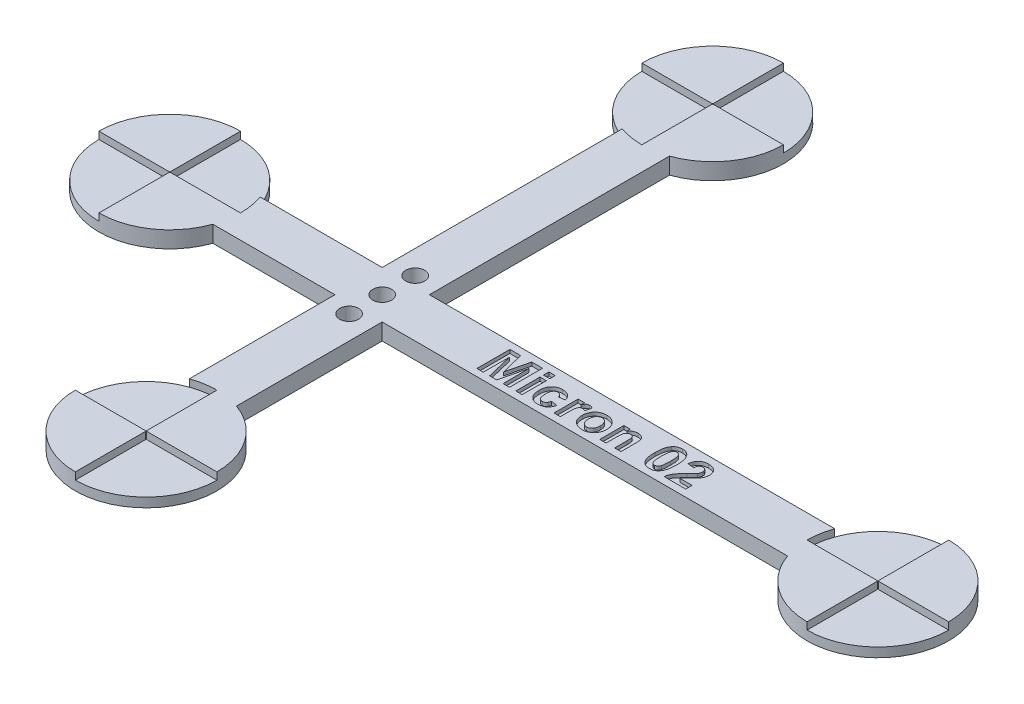
from build123d import *

# Parameters (mm, degrees)
BOSS_EXTRUDE1_DEPTH = 3.5
CUT_EXTRUDE1_START  = -1.52
CUT_EXTRUDE1_DEPTH  = 1.52
SKETCH3_R           = 2
CUT_EXTRUDE2_DEPTH  = 186.640108813
SKETCH5_W           = 1.346153846
SKETCH5_H           = 1.166666667
SKETCH5_H_2         = 5.115384615
CUT_EXTRUDE3_DEPTH  = 0.75


with BuildPart() as part:
    # Sketch1 → Boss-Extrude1 (new body)
    with BuildSketch(Plane(origin=(0, 0, 0), x_dir=(1, 0, 0), z_dir=(0, 1, 0))):
        with BuildLine():
            Line((40, 55.857864376), (40, 5))
            Line((40, 5), (14.142135624, 5))
            ThreePointArc((14.142135624, 5), (-15, 0), (14.142135624, -5))
            Line((14.142135624, -5), (40, -5))
            Line((40, -5), (40, -35.857864376))
            ThreePointArc((40, -35.857864376), (45, -65), (50, -35.857864376))
            Line((50, -35.857864376), (50, -5))
            Line((50, -5), (135.857864376, -5))
            ThreePointArc((135.857864376, -5), (165, 0), (135.857864376, 5))
            Line((135.857864376, 5), (50, 5))
            Line((50, 5), (50, 55.857864376))
            ThreePointArc((50, 55.857864376), (45, 85), (40, 55.857864376))
        make_face()
    extrude(amount=BOSS_EXTRUDE1_DEPTH)

    # Sketch2 → Cut-Extrude1 (cut)
    with BuildSketch(Plane(origin=(0, 3.5, 0), x_dir=(1, 0, 0), z_dir=(0, 1, 0)).offset(CUT_EXTRUDE1_START)):
        with BuildLine():
            Line((45, -65), (45, -50.1))
            ThreePointArc((45, -50.1), (44.929289322, -50.070710678), (44.9, -50))
            Line((44.9, -50), (30, -50))
            ThreePointArc((30, -50), (34.393398282, -39.393398282), (45, -35))
            Line((45, -35), (45, -49.9))
            ThreePointArc((45, -49.9), (45.070710678, -49.929289322), (45.1, -50))
            Line((45.1, -50), (60, -50))
            ThreePointArc((60, -50), (55.606601718, -60.606601718), (45, -65))
        make_face()
        with BuildLine():
            Line((-15, 0), (-0.1, 0))
            ThreePointArc((-0.1, 0), (-0.070710678, 0.070710678), (0, 0.1))
            Line((0, 0.1), (0, 15))
            ThreePointArc((0, 15), (10.606601718, 10.606601718), (15, 0))
            Line((15, 0), (0.1, 0))
            ThreePointArc((0.1, 0), (0.070710678, -0.070710678), (0, -0.1))
            Line((0, -0.1), (0, -15))
            ThreePointArc((0, -15), (-10.606601718, -10.606601718), (-15, 0))
        make_face()
        with BuildLine():
            Line((30, 70), (44.9, 70))
            ThreePointArc((44.9, 70), (44.929289322, 70.070710678), (45, 70.1))
            Line((45, 70.1), (45, 85))
            ThreePointArc((45, 85), (55.606601718, 80.606601718), (60, 70))
            Line((60, 70), (45.1, 70))
            ThreePointArc((45.1, 70), (45.070710678, 69.929289322), (45, 69.9))
            Line((45, 69.9), (45, 55))
            ThreePointArc((45, 55), (34.393398282, 59.393398282), (30, 70))
        make_face()
        with BuildLine():
            Line((150, 15), (150, 0.1))
            ThreePointArc((150, 0.1), (150.070710678, 0.070710678), (150.1, 0))
            Line((150.1, 0), (165, 0))
            ThreePointArc((165, 0), (160.606601718, -10.606601718), (150, -15))
            Line((150, -15), (150, -0.1))
            ThreePointArc((150, -0.1), (149.929289322, -0.070710678), (149.9, 0))
            Line((149.9, 0), (135, 0))
            ThreePointArc((135, 0), (139.393398282, 10.606601718), (150, 15))
        make_face()
    extrude(amount=CUT_EXTRUDE1_DEPTH, mode=Mode.SUBTRACT)

    # Sketch3 → Cut-Extrude2 (cut, through all)
    with BuildSketch(Plane(origin=(0, 3.5, 0), x_dir=(1, 0, 0), z_dir=(0, 1, 0))):
        with Locations(Location((45, 0, 0), (0, 0, 270))):
            Circle(SKETCH3_R)
        with Locations(Location((45, 7, 0), (0, 0, 270))):
            Circle(SKETCH3_R)
        with Locations(Location((45, -7, 0), (0, 0, 270))):
            Circle(SKETCH3_R)
    extrude(amount=-CUT_EXTRUDE2_DEPTH, mode=Mode.SUBTRACT)

    # Sketch5 → Cut-Extrude3 (cut)
    # profile 1 of 9: a face of its own
    with BuildSketch(Plane(origin=(0, 3.5, 0), x_dir=(1, 0, 0), z_dir=(0, 1, 0))):
        Polygon((68.557137316, -3.5), (68.557137316, 3.5), (70.834380906, 3.5), (72.012265521, -1.274639423), (73.190150137, 3.5), (75.467393727, 3.5), (75.467393727, -3.5), (74.12123988, -3.5), (74.076368086, 2.010817308), (72.762465842, -3.5), (71.262065201, -3.5), (69.948162957, 2.010817308), (69.903291162, -3.5), align=None)
    # profile 2 of 9: a face of its own
    with BuildSketch(Plane(origin=(0, 3.5, 0), x_dir=(1, 0, 0), z_dir=(0, 1, 0))):
        with Locations((77.486624496, 2.916666667)):
            Rectangle(SKETCH5_W, SKETCH5_H)
    # profile 3 of 9: a face of its own
    with BuildSketch(Plane(origin=(0, 3.5, 0), x_dir=(1, 0, 0), z_dir=(0, 1, 0))):
        with Locations((77.486624496, -0.942307692)):
            Rectangle(SKETCH5_W, SKETCH5_H_2)
    # profile 4 of 9: a face of its own
    with BuildSketch(Plane(origin=(0, 3.5, 0), x_dir=(1, 0, 0), z_dir=(0, 1, 0))):
        with BuildLine():
            Line((83.723803983, 0.08974359), (82.377650137, -0.08974359))
            add(Edge.make_bspline(
                [(82.377650137, -0.08974359), (82.365277654, -0.026702881), (82.341673882, 0.09356389), (82.281826173, 0.260113107), (82.199974577, 0.401670835), (82.097611893, 0.51732494), (81.97712351, 0.607450251), (81.840268759, 0.673171422), (81.685581657, 0.711401306), (81.577185865, 0.715710363), (81.520879304, 0.717948718)],
                knots=[0, 0, 0, 0, 1.183520367, 2.2578771, 3.246797608, 4.180863388, 5.085846032, 6.003342148, 6.962829327, 8, 8, 8, 8], degree=3))
            add(Edge.make_bspline(
                [(81.520879304, 0.717948718), (81.482498221, 0.716894897), (81.407684642, 0.714840756), (81.298251479, 0.698098117), (81.195737937, 0.667745464), (81.097523133, 0.629114343), (81.006836345, 0.576495155), (80.920991012, 0.514299213), (80.842675236, 0.439090326), (80.769257744, 0.353129964), (80.701753909, 0.253995306), (80.647051205, 0.137976859), (80.599085607, 0.00804074), (80.560102543, -0.137503523), (80.530047591, -0.298346655), (80.507427047, -0.474341951), (80.495339603, -0.665426066), (80.493822197, -0.797860734), (80.493034752, -0.866586538)],
                knots=[0, 0, 0, 0, 0.862078219, 1.680389174, 2.478024961, 3.259954283, 4.04533088, 4.826625376, 5.636266677, 6.477958853, 7.363321064, 8.321359119, 9.351280941, 10.472100686, 11.701575432, 13.024867311, 14.456081111, 16, 16, 16, 16], degree=3))
            add(Edge.make_bspline(
                [(80.493034752, -0.866586538), (80.493639899, -0.942801282), (80.494806774, -1.089762544), (80.509341595, -1.301712899), (80.531002417, -1.496036651), (80.561525189, -1.673267835), (80.601624875, -1.832782613), (80.650795425, -1.975411342), (80.707047794, -2.101633999), (80.776070584, -2.209065714), (80.850031931, -2.303056702), (80.933314865, -2.381466575), (81.019308158, -2.451942196), (81.114884123, -2.505825956), (81.214352737, -2.550853781), (81.321603773, -2.578852356), (81.433547011, -2.60039896), (81.510950539, -2.601834056), (81.550326419, -2.602564103)],
                knots=[0, 0, 0, 0, 1.594318435, 3.074248329, 4.44256617, 5.683784585, 6.834147545, 7.879495874, 8.83778105, 9.716843238, 10.544636748, 11.333080285, 12.105903466, 12.864046512, 13.621684801, 14.38335177, 15.177596319, 16, 16, 16, 16], degree=3))
            add(Edge.make_bspline(
                [(81.550326419, -2.602564103), (81.608100413, -2.600080116), (81.720157046, -2.595262252), (81.879276685, -2.552096012), (82.022202191, -2.482192159), (82.125844391, -2.400004579), (82.201111917, -2.320853296), (82.250138108, -2.247946339), (82.299458931, -2.168177702), (82.339930185, -2.075871785), (82.380235919, -1.975436952), (82.412480151, -1.86369039), (82.444507148, -1.743466381), (82.459601538, -1.65899259), (82.467393727, -1.615384615)],
                knots=[0, 0, 0, 0, 1.391704634, 2.699306801, 3.945045311, 5.206156062, 5.868460975, 6.572467336, 7.320954464, 8.128297893, 8.999513781, 9.930638866, 10.931732014, 12, 12, 12, 12], degree=3))
            Line((82.467393727, -1.615384615), (83.813547573, -1.794871795))
            add(Edge.make_bspline(
                [(83.813547573, -1.794871795), (83.795825896, -1.866656924), (83.76109447, -2.007343377), (83.693590707, -2.209373129), (83.61479608, -2.39820651), (83.525624874, -2.574376956), (83.422745577, -2.73598165), (83.309013151, -2.88413537), (83.183178776, -3.017960811), (83.046861568, -3.139555075), (82.897935718, -3.246410319), (82.736172899, -3.337665389), (82.563936639, -3.416820643), (82.378388792, -3.479144939), (82.181836268, -3.530502493), (81.972413371, -3.564327421), (81.751309208, -3.58604953), (81.599927011, -3.588491221), (81.522281547, -3.58974359)],
                knots=[0, 0, 0, 0, 1.110268429, 2.175934317, 3.195555169, 4.181481111, 5.137790904, 6.068820232, 6.982751273, 7.892872169, 8.808581235, 9.729898078, 10.678730826, 11.651191499, 12.666063818, 13.726769105, 14.834036833, 16, 16, 16, 16], degree=3))
            add(Edge.make_bspline(
                [(81.522281547, -3.58974359), (81.433837068, -3.587598112), (81.261478322, -3.583417051), (81.009756242, -3.550566524), (80.771780691, -3.496564037), (80.547501703, -3.418433664), (80.33596962, -3.32101378), (80.139359833, -3.198661043), (79.956602846, -3.055097693), (79.788125382, -2.890737636), (79.63650412, -2.707369312), (79.505615698, -2.505114604), (79.394554044, -2.286498364), (79.303031081, -2.051298732), (79.233226582, -1.7983952), (79.183681025, -1.529069784), (79.151714713, -1.243154327), (79.148519923, -1.047097203), (79.146880906, -0.946514423)],
                knots=[0, 0, 0, 0, 1.056003706, 2.057917874, 3.026125023, 3.965316587, 4.889355399, 5.801804771, 6.724223409, 7.659808022, 8.607570672, 9.559810849, 10.530974559, 11.531347954, 12.568834288, 13.659317828, 14.799164681, 16, 16, 16, 16], degree=3))
            add(Edge.make_bspline(
                [(79.146880906, -0.946514423), (79.148524185, -0.844997295), (79.151727972, -0.647076357), (79.18360297, -0.358828298), (79.233094763, -0.087580716), (79.30349607, 0.166297338), (79.392466257, 0.40326616), (79.504363423, 0.62183937), (79.635046938, 0.82419118), (79.786794153, 1.007446493), (79.954769379, 1.171954778), (80.138621428, 1.31436025), (80.335702579, 1.436043892), (80.547842096, 1.534147473), (80.773642785, 1.612120293), (81.013992037, 1.665925315), (81.268498667, 1.698802364), (81.442718724, 1.702983298), (81.532097252, 1.705128205)],
                knots=[0, 0, 0, 0, 1.206261992, 2.351765734, 3.442553085, 4.480484798, 5.479315179, 6.445885781, 7.393622348, 8.336902565, 9.26806234, 10.182699256, 11.09556262, 12.0152312, 12.955233282, 13.92969179, 14.937888647, 16, 16, 16, 16], degree=3))
            add(Edge.make_bspline(
                [(81.532097252, 1.705128205), (81.605070142, 1.704384231), (81.747559928, 1.702931518), (81.955377865, 1.681938632), (82.151931544, 1.652324627), (82.3370707, 1.608373074), (82.510877772, 1.55291005), (82.67305557, 1.48425635), (82.822943463, 1.401899226), (82.962440511, 1.308174096), (83.090726225, 1.200105), (83.210447231, 1.080931127), (83.320267383, 0.947732157), (83.421478043, 0.802315403), (83.510713897, 0.64234233), (83.592738582, 0.470830941), (83.663920966, 0.285320122), (83.703546565, 0.155903844), (83.723803983, 0.08974359)],
                knots=[0, 0, 0, 0, 1.178528697, 2.301242291, 3.371523624, 4.388184023, 5.372173667, 6.316227488, 7.228761945, 8.131556558, 9.02696084, 9.934795517, 10.857276148, 11.812560878, 12.793328268, 13.813516901, 14.882225015, 16, 16, 16, 16], degree=3))
        make_face()
    # profile 5 of 9: a face of its own
    with BuildSketch(Plane(origin=(0, 3.5, 0), x_dir=(1, 0, 0), z_dir=(0, 1, 0))):
        with BuildLine():
            Line((86.236624496, -3.5), (84.89047065, -3.5))
            Line((84.89047065, -3.5), (84.89047065, 1.615384615))
            Line((84.89047065, 1.615384615), (86.236624496, 1.615384615))
            Line((86.236624496, 1.615384615), (86.236624496, 0.901642628))
            add(Edge.make_bspline(
                [(86.236624496, 0.901642628), (86.259883743, 0.941904311), (86.304756328, 1.019578614), (86.371134323, 1.130348316), (86.437190473, 1.229067778), (86.502313101, 1.315738052), (86.562695006, 1.393610289), (86.624125097, 1.458290396), (86.681838486, 1.513862665), (86.759057766, 1.569417784), (86.85816177, 1.623638198), (86.982722375, 1.672376349), (87.116123027, 1.699014333), (87.206867798, 1.7030602), (87.253251098, 1.705128205)],
                knots=[0, 0, 0, 0, 1.218987753, 2.351715484, 3.384890168, 4.330893419, 5.1939795, 5.965577503, 6.66790098, 7.29043559, 8.453252551, 9.620708942, 10.783848683, 12, 12, 12, 12], degree=3))
            add(Edge.make_bspline(
                [(87.253251098, 1.705128205), (87.320405095, 1.701358096), (87.455282291, 1.693785921), (87.655090934, 1.639699112), (87.849368018, 1.548142305), (87.969512799, 1.464847397), (88.031496291, 1.421875)],
                knots=[0, 0, 0, 0, 0.956058025, 1.920219652, 2.927027487, 4, 4, 4, 4], degree=3))
            Line((88.031496291, 1.421875), (87.717393727, 0.141626603))
            add(Edge.make_bspline(
                [(87.717393727, 0.141626603), (87.664449803, 0.174925236), (87.563581431, 0.238365546), (87.406138295, 0.305762948), (87.25470486, 0.349888023), (87.154428404, 0.35601587), (87.106015521, 0.358974359)],
                knots=[0, 0, 0, 0, 1.139741959, 2.17142794, 3.117176162, 4, 4, 4, 4], degree=3))
            add(Edge.make_bspline(
                [(87.106015521, 0.358974359), (87.062383442, 0.357110478), (86.977443556, 0.353482004), (86.855168651, 0.324585509), (86.742438401, 0.278028965), (86.638804629, 0.211102954), (86.546124762, 0.117496866), (86.466335118, -0.005816935), (86.399557381, -0.159976511), (86.348517599, -0.309611834), (86.316692358, -0.455051639), (86.294248724, -0.593539742), (86.277196049, -0.759330249), (86.261585532, -0.951920701), (86.251121722, -1.171736755), (86.242884255, -1.418086441), (86.236934639, -1.691545137), (86.236731023, -1.882742337), (86.236624496, -1.982772436)],
                knots=[0, 0, 0, 0, 0.752818562, 1.4655346, 2.15662141, 2.850671748, 3.581264886, 4.414089304, 5.371394652, 6.476667933, 7.138571115, 7.940099809, 8.898357565, 10.015825393, 11.276710544, 12.698206094, 14.272575274, 16, 16, 16, 16], degree=3))
            Line((86.236624496, -1.982772436), (86.236624496, -3.5))
        make_face()
    # profile 6 of 9: a face of its own
    with BuildSketch(Plane(origin=(0, 3.5, 0), x_dir=(1, 0, 0), z_dir=(0, 1, 0))):
        with BuildLine():
            add(Edge.make_bspline(
                [(88.30072706, -0.870793269), (88.305045962, -0.760235903), (88.313692137, -0.538906871), (88.37545065, -0.210134176), (88.479986613, 0.112038713), (88.596998472, 0.373436964), (88.712536167, 0.573274145), (88.805840225, 0.717377785), (88.910004027, 0.850655554), (89.022895624, 0.973952054), (89.141975554, 1.090223099), (89.271436787, 1.195191373), (89.409604934, 1.290665645), (89.555130892, 1.377699163), (89.70780662, 1.45411696), (89.864797668, 1.522044624), (90.026738449, 1.577858255), (90.192500665, 1.624143401), (90.362803099, 1.66126573), (90.537692719, 1.68557028), (90.716957733, 1.701776453), (90.837816813, 1.704000672), (90.899084432, 1.705128205)],
                knots=[0, 0, 0, 0, 1.619840069, 3.242819969, 4.882696853, 6.574901176, 7.427927767, 8.263869039, 9.088735507, 9.903385011, 10.712399333, 11.525463381, 12.34252837, 13.171904741, 14.008210778, 14.842888174, 15.67691885, 16.516221154, 17.363978437, 18.229048737, 19.10224397, 20, 20, 20, 20], degree=3))
            add(Edge.make_bspline(
                [(90.899084432, 1.705128205), (90.992210311, 1.703136544), (91.175407967, 1.69921854), (91.443599, 1.663530133), (91.69856042, 1.604734262), (91.940636298, 1.522866388), (92.170009096, 1.417918164), (92.385525042, 1.287469155), (92.588964705, 1.13534666), (92.776477597, 0.960622814), (92.947873031, 0.769310702), (93.096522834, 0.562484273), (93.223397384, 0.344144411), (93.328477544, 0.113944009), (93.408239879, -0.129331778), (93.463344151, -0.385087436), (93.500243667, -0.652374343), (93.50396088, -0.835142162), (93.505855265, -0.928285256)],
                knots=[0, 0, 0, 0, 1.076054793, 2.116819909, 3.120736197, 4.09633837, 5.065772102, 6.030360709, 7.002891056, 7.996945094, 8.988102315, 9.967288529, 10.93568283, 11.902870597, 12.887008047, 13.888537105, 14.923945207, 16, 16, 16, 16], degree=3))
            add(Edge.make_bspline(
                [(93.505855265, -0.928285256), (93.503953336, -1.022358858), (93.500230128, -1.20651696), (93.463550334, -1.47628572), (93.406832368, -1.734301905), (93.325441844, -1.980042151), (93.220586913, -2.213224526), (93.094263796, -2.434645511), (92.943126034, -2.643140663), (92.770071096, -2.836536926), (92.580135887, -3.012216977), (92.378157233, -3.168393642), (92.161698021, -3.297146595), (91.934555313, -3.405413896), (91.694392155, -3.48757604), (91.442576838, -3.546181121), (91.179301383, -3.58440277), (90.999247208, -3.587940756), (90.907497893, -3.58974359)],
                knots=[0, 0, 0, 0, 1.084306555, 2.122634113, 3.133511532, 4.127271514, 5.10202058, 6.077484774, 7.061903265, 8.065960046, 9.065303363, 10.042062392, 11.004391854, 11.964060687, 12.939122686, 13.924942149, 14.942623041, 16, 16, 16, 16], degree=3))
            add(Edge.make_bspline(
                [(90.907497893, -3.58974359), (90.793197459, -3.585999314), (90.565409876, -3.578537406), (90.228332141, -3.517331391), (89.899580393, -3.418578363), (89.634721788, -3.30491006), (89.432398884, -3.194068459), (89.2889167, -3.100765628), (89.153600151, -3.000634417), (89.029615405, -2.888525117), (88.914822638, -2.767656905), (88.80770116, -2.639200059), (88.712065202, -2.500189519), (88.625243515, -2.353150853), (88.547337372, -2.197033104), (88.482391397, -2.031407384), (88.425965203, -1.858219085), (88.379426741, -1.677074935), (88.344918868, -1.487198195), (88.319828269, -1.289197267), (88.304105213, -1.082783839), (88.301867118, -0.942335777), (88.30072706, -0.870793269)],
                knots=[0, 0, 0, 0, 1.610846835, 3.210231987, 4.81374032, 6.443368681, 7.263437361, 8.06418174, 8.855100662, 9.634539345, 10.417731031, 11.204243685, 11.990424874, 12.794120493, 13.610605693, 14.447765341, 15.300248309, 16.177865431, 17.082777535, 18.019649293, 18.991233806, 20, 20, 20, 20], degree=3))
        make_face()
        with BuildLine():
            add(Edge.make_bspline(
                [(89.646880906, -0.942307692), (89.647878584, -1.007320767), (89.649820064, -1.133836228), (89.667123886, -1.317908247), (89.693943922, -1.490762442), (89.735361519, -1.650791958), (89.785307076, -1.800159307), (89.848707519, -1.936877885), (89.921153825, -2.063536994), (90.007373027, -2.1753987), (90.101343593, -2.274418694), (90.199833871, -2.36240354), (90.303809872, -2.437322036), (90.41391022, -2.49823268), (90.529998823, -2.544473448), (90.650705668, -2.578404662), (90.776898878, -2.59833825), (90.862556349, -2.601139991), (90.90609565, -2.602564103)],
                knots=[0, 0, 0, 0, 1.334287467, 2.596523749, 3.792235791, 4.920928783, 5.98599801, 7.020725633, 8.009778093, 8.975087571, 9.91178927, 10.809031968, 11.682407688, 12.537028737, 13.385161363, 14.241880569, 15.106355953, 16, 16, 16, 16], degree=3))
            add(Edge.make_bspline(
                [(90.90609565, -2.602564103), (90.949636837, -2.601144665), (91.035298021, -2.598352119), (91.161464162, -2.578351489), (91.281853749, -2.544786823), (91.397190506, -2.497854846), (91.507005984, -2.437377328), (91.61091724, -2.362353397), (91.709336483, -2.274781598), (91.802542893, -2.175227372), (91.886267606, -2.061842509), (91.959423839, -1.935578805), (92.022822325, -1.79833688), (92.072998654, -1.64817726), (92.112146338, -1.486306038), (92.139600285, -1.312329148), (92.15676443, -1.126346658), (92.158702325, -0.99843674), (92.159701419, -0.932491987)],
                knots=[0, 0, 0, 0, 0.891374549, 1.753654511, 2.608197993, 3.445305504, 4.297756158, 5.168913853, 6.063877914, 6.991658187, 7.956416983, 8.942957645, 9.975057474, 11.046479855, 12.179282068, 13.381405243, 14.649967197, 16, 16, 16, 16], degree=3))
            add(Edge.make_bspline(
                [(92.159701419, -0.932491987), (92.158697367, -0.867950124), (92.156751088, -0.742840612), (92.139683714, -0.561031756), (92.111771172, -0.390422553), (92.073298945, -0.231185172), (92.022561895, -0.083047614), (91.959026888, 0.052619974), (91.886748624, 0.178516236), (91.80205349, 0.290714614), (91.709395678, 0.390209804), (91.610902071, 0.477726842), (91.507009908, 0.552764833), (91.397189486, 0.61323871), (91.281854027, 0.660171642), (91.161464087, 0.693736048), (91.035298041, 0.713736749), (90.949636844, 0.716529285), (90.90609565, 0.717948718)],
                knots=[0, 0, 0, 0, 1.332105243, 2.582185114, 3.76554119, 4.898206757, 5.96011018, 6.991864232, 7.986448439, 8.951336849, 9.886681577, 10.788942532, 11.667203022, 12.526603947, 13.370536632, 14.232047448, 15.101357822, 16, 16, 16, 16], degree=3))
            add(Edge.make_bspline(
                [(90.90609565, 0.717948718), (90.862556349, 0.716524606), (90.776898878, 0.713722865), (90.650705668, 0.693789278), (90.529998823, 0.659858063), (90.41391022, 0.613617296), (90.303809872, 0.552706651), (90.199833871, 0.477788156), (90.101343593, 0.38980331), (90.007373027, 0.290783316), (89.921153825, 0.17892161), (89.848707519, 0.052262501), (89.785307076, -0.084456078), (89.735361519, -0.233823426), (89.693943922, -0.393852943), (89.667123886, -0.566707137), (89.649820064, -0.750779157), (89.647878584, -0.877294617), (89.646880906, -0.942307692)],
                knots=[0, 0, 0, 0, 0.893644047, 1.758119431, 2.614838637, 3.462971263, 4.317592312, 5.190968032, 6.08821073, 7.024912429, 7.990221907, 8.979274367, 10.01400199, 11.079071217, 12.207764209, 13.403476251, 14.665712533, 16, 16, 16, 16], degree=3))
        make_face(mode=Mode.SUBTRACT)
    # profile 7 of 9: a face of its own
    with BuildSketch(Plane(origin=(0, 3.5, 0), x_dir=(1, 0, 0), z_dir=(0, 1, 0))):
        with BuildLine():
            Line((99.069957829, -3.5), (97.723803983, -3.5))
            Line((97.723803983, -3.5), (97.723803983, -0.875))
            add(Edge.make_bspline(
                [(97.723803983, -0.875), (97.723602692, -0.80862339), (97.723218494, -0.681932094), (97.718527885, -0.50151225), (97.713477967, -0.33926398), (97.705359809, -0.195690673), (97.69420945, -0.069881136), (97.680940928, 0.037381776), (97.664227581, 0.126316058), (97.640514055, 0.219075396), (97.603280694, 0.31750614), (97.542853534, 0.419454306), (97.472803641, 0.509977418), (97.387946168, 0.584030176), (97.292843867, 0.643744945), (97.188425092, 0.687766967), (97.073926815, 0.713473714), (96.994769027, 0.71642676), (96.953972252, 0.717948718)],
                knots=[0, 0, 0, 0, 1.585090075, 3.025419896, 4.30986405, 5.461533023, 6.458985685, 7.325703005, 8.041573048, 8.618245387, 9.611190897, 10.541623111, 11.439410311, 12.333024322, 13.215695708, 14.111259627, 15.026570636, 16, 16, 16, 16], degree=3))
            add(Edge.make_bspline(
                [(96.953972252, 0.717948718), (96.901446439, 0.715341443), (96.798008909, 0.710207014), (96.646127096, 0.674643139), (96.504272122, 0.611656212), (96.371854194, 0.527573319), (96.255091054, 0.423166044), (96.155813236, 0.301229295), (96.077510643, 0.163292863), (96.028725935, 0.034500293), (95.9997776, -0.082074788), (95.980077313, -0.18736516), (95.965963353, -0.310222482), (95.951055688, -0.449397921), (95.942646526, -0.606201002), (95.933263474, -0.779079665), (95.929808832, -0.969405207), (95.929233196, -1.1016966), (95.928932188, -1.170873397)],
                knots=[0, 0, 0, 0, 1.032418065, 2.033110358, 3.045378521, 4.070039643, 5.104744895, 6.110696385, 7.147805894, 8.209255037, 8.806501049, 9.507534436, 10.313289552, 11.236712342, 12.258650821, 13.399345464, 14.640085731, 16, 16, 16, 16], degree=3))
            Line((95.928932188, -1.170873397), (95.928932188, -3.5))
            Line((95.928932188, -3.5), (94.582778342, -3.5))
            Line((94.582778342, -3.5), (94.582778342, 1.615384615))
            Line((94.582778342, 1.615384615), (95.928932188, 1.615384615))
            Line((95.928932188, 1.615384615), (95.928932188, 0.877804487))
            add(Edge.make_bspline(
                [(95.928932188, 0.877804487), (95.980976174, 0.94337945), (96.08236259, 1.07112544), (96.252101926, 1.240902011), (96.431871591, 1.384984638), (96.622482327, 1.502597736), (96.823836354, 1.593383288), (97.035011442, 1.657323362), (97.256181645, 1.698687167), (97.407176778, 1.702955825), (97.484020329, 1.705128205)],
                knots=[0, 0, 0, 0, 1.096260936, 2.135615983, 3.138008533, 4.108575778, 5.062498258, 6.023394349, 6.994077526, 8, 8, 8, 8], degree=3))
            add(Edge.make_bspline(
                [(97.484020329, 1.705128205), (97.551455459, 1.703432581), (97.684254807, 1.700093404), (97.87840855, 1.668042033), (98.063790206, 1.617716821), (98.237815142, 1.547521772), (98.39780225, 1.463814733), (98.538360931, 1.365944084), (98.659178646, 1.258012012), (98.758264399, 1.136836476), (98.838935335, 1.006444736), (98.909151731, 0.869613801), (98.963410859, 0.7231182), (99.005291646, 0.56393665), (99.033684021, 0.383505727), (99.056317805, 0.173923523), (99.067737625, -0.069988674), (99.069186888, -0.243982006), (99.069957829, -0.336538462)],
                knots=[0, 0, 0, 0, 1.087471829, 2.141547729, 3.166311014, 4.181815879, 5.163737, 6.073971965, 6.939083136, 7.769667735, 8.590016746, 9.409741311, 10.247555639, 11.105633939, 12.06171977, 13.192085209, 14.506318385, 16, 16, 16, 16], degree=3))
            Line((99.069957829, -0.336538462), (99.069957829, -3.5))
        make_face()
    # profile 8 of 9: a face of its own
    with BuildSketch(Plane(origin=(0, 3.5, 0), x_dir=(1, 0, 0), z_dir=(0, 1, 0))):
        with BuildLine():
            add(Edge.make_bspline(
                [(105.127650137, 3.5), (105.210973459, 3.497990296), (105.373194416, 3.494077632), (105.609568213, 3.459418509), (105.832125907, 3.403844539), (106.040851165, 3.325286793), (106.235548447, 3.223275021), (106.414920872, 3.097373283), (106.582887972, 2.951355615), (106.679882834, 2.838043484), (106.729012316, 2.780649038)],
                knots=[0, 0, 0, 0, 1.098584764, 2.138818609, 3.143716932, 4.11936356, 5.073598562, 6.034819447, 7.004603936, 8, 8, 8, 8], degree=3))
            add(Edge.make_bspline(
                [(106.729012316, 2.780649038), (106.757115165, 2.744096358), (106.814468155, 2.669498744), (106.89170974, 2.548957239), (106.965967015, 2.421089291), (107.030786368, 2.282817073), (107.092853708, 2.136540065), (107.150372484, 1.981924967), (107.200314244, 1.817694297), (107.24730652, 1.645948025), (107.285600914, 1.464003892), (107.320988477, 1.273826094), (107.350326359, 1.07455247), (107.373461009, 0.866820582), (107.394122544, 0.650946485), (107.405444064, 0.425900053), (107.414713976, 0.192183791), (107.415640415, 0.033196977), (107.416111675, -0.047676282)],
                knots=[0, 0, 0, 0, 0.746761706, 1.524009783, 2.317797294, 3.140957436, 3.996208027, 4.892396322, 5.812273159, 6.776774596, 7.776522781, 8.823794876, 9.910947555, 11.039215469, 12.21036455, 13.424061321, 14.689674014, 16, 16, 16, 16], degree=3))
            add(Edge.make_bspline(
                [(107.416111675, -0.047676282), (107.415647514, -0.128549727), (107.414737711, -0.287069766), (107.405409505, -0.520317147), (107.394112451, -0.744894367), (107.37350921, -0.960779993), (107.350153056, -1.168470585), (107.32165396, -1.36752083), (107.283603433, -1.556824756), (107.245911455, -1.7384787), (107.199194678, -1.910956219), (107.147008626, -2.074892373), (107.09180168, -2.231434895), (107.028291268, -2.377900211), (106.961146178, -2.516343538), (106.887993989, -2.64551665), (106.809889936, -2.766805201), (106.751982092, -2.841796361), (106.723403342, -2.87880609)],
                knots=[0, 0, 0, 0, 1.308387162, 2.564569672, 3.776470597, 4.945886788, 6.07248526, 7.158029334, 8.197718558, 9.195987466, 10.159061779, 11.087054987, 11.979325145, 12.84323098, 13.668471539, 14.467659354, 15.243757377, 16, 16, 16, 16], degree=3))
            add(Edge.make_bspline(
                [(106.723403342, -2.87880609), (106.674723363, -2.935708583), (106.578626735, -3.048036851), (106.412518637, -3.192843578), (106.233443571, -3.316141502), (106.039089218, -3.416126038), (105.831383863, -3.495225841), (105.60846196, -3.549026443), (105.372733911, -3.583756125), (105.210509985, -3.587719301), (105.127650137, -3.58974359)],
                knots=[0, 0, 0, 0, 0.991631672, 1.957528776, 2.911425699, 3.867574088, 4.848108326, 5.850523106, 6.902101959, 8, 8, 8, 8], degree=3))
            add(Edge.make_bspline(
                [(105.127650137, -3.58974359), (105.043843229, -3.587332075), (104.87961925, -3.582606588), (104.639845122, -3.545146301), (104.411928808, -3.485135154), (104.196688524, -3.399455235), (103.99443224, -3.288420347), (103.80357985, -3.155320137), (103.628283527, -2.994127791), (103.491045634, -2.844066609), (103.390641979, -2.708475295), (103.319827907, -2.596038127), (103.251393654, -2.475725869), (103.192326668, -2.343776957), (103.134051837, -2.204094043), (103.08243865, -2.05366677), (103.036902449, -1.893788664), (102.994146853, -1.725189777), (102.958494985, -1.546708789), (102.925700499, -1.358872406), (102.899856676, -1.160881808), (102.876943465, -0.953839776), (102.860811252, -0.737257565), (102.847709837, -0.5114896), (102.841140381, -0.275813207), (102.839847904, -0.115454427), (102.839188598, -0.033653846)],
                knots=[0, 0, 0, 0, 1.257818097, 2.464759732, 3.634271214, 4.790227596, 5.933394726, 7.09190477, 8.274482889, 9.50191983, 10.139172818, 10.805000628, 11.49619854, 12.215266328, 12.973768034, 13.768328009, 14.601232062, 15.469317089, 16.379095881, 17.333267023, 18.331755967, 19.376479622, 20.460535752, 21.592206075, 22.771760786, 24, 24, 24, 24], degree=3))
            add(Edge.make_bspline(
                [(102.839188598, -0.033653846), (102.839649053, 0.046752502), (102.840551486, 0.204338611), (102.849947717, 0.43664665), (102.861095479, 0.6603017), (102.881922973, 0.875695222), (102.904951542, 1.082498955), (102.93397868, 1.280985552), (102.971083155, 1.47012808), (103.011481896, 1.65068144), (103.055796554, 1.823285057), (103.10846774, 1.986496157), (103.163122902, 2.142783223), (103.227375619, 2.288467292), (103.294108477, 2.426619238), (103.367317908, 2.555768146), (103.445407553, 2.677062789), (103.503317262, 2.75205316), (103.531896932, 2.7890625)],
                knots=[0, 0, 0, 0, 1.304469132, 2.556591843, 3.77188756, 4.93702727, 6.066781583, 7.147865049, 8.190466662, 9.19316792, 10.149665317, 11.080258032, 11.975027628, 12.834388201, 13.661940433, 14.463366943, 15.241638981, 16, 16, 16, 16], degree=3))
            add(Edge.make_bspline(
                [(103.531896932, 2.7890625), (103.580574234, 2.845970467), (103.676665577, 2.958309541), (103.842812364, 3.103037161), (104.022085413, 3.226867293), (104.217008558, 3.32565506), (104.424237765, 3.405839286), (104.646867933, 3.45921057), (104.882558423, 3.494031913), (105.044787604, 3.497982262), (105.127650137, 3.5)],
                knots=[0, 0, 0, 0, 0.991667276, 1.957599061, 2.911530233, 3.873218945, 4.847995157, 5.850445929, 6.902062539, 8, 8, 8, 8], degree=3))
        make_face()
        with BuildLine():
            add(Edge.make_bspline(
                [(105.127650137, 2.333333333), (105.08496527, 2.331377346), (105.000530703, 2.327508224), (104.877806939, 2.298834269), (104.761904466, 2.251515994), (104.65226456, 2.185460295), (104.551309982, 2.09356773), (104.46579241, 1.970359526), (104.391937624, 1.819162626), (104.35497736, 1.706149177), (104.335382509, 1.646233974)],
                knots=[0, 0, 0, 0, 0.899391665, 1.779078861, 2.640979247, 3.529945348, 4.464599804, 5.495588918, 6.672261578, 8, 8, 8, 8], degree=3))
            add(Edge.make_bspline(
                [(104.335382509, 1.646233974), (104.323145186, 1.601026296), (104.296843942, 1.503863032), (104.266993122, 1.34544653), (104.242375766, 1.165660571), (104.221588896, 0.964546936), (104.204672766, 0.741999201), (104.19425523, 0.497875761), (104.187054818, 0.232347672), (104.185928426, 0.048149154), (104.185342445, -0.047676282)],
                knots=[0, 0, 0, 0, 0.658986521, 1.416336438, 2.266694271, 3.212608458, 4.261595115, 5.407496572, 6.651304179, 8, 8, 8, 8], degree=3))
            add(Edge.make_bspline(
                [(104.185342445, -0.047676282), (104.186141326, -0.14302767), (104.187672646, -0.32580029), (104.19202109, -0.588135115), (104.204364221, -0.826933735), (104.216718503, -1.043147789), (104.237295105, -1.23609601), (104.257990887, -1.406299418), (104.286516619, -1.552595599), (104.325438332, -1.711718991), (104.384302432, -1.878266865), (104.465062219, -2.04628923), (104.551664335, -2.181203321), (104.6536661, -2.277800907), (104.764061896, -2.342600939), (104.878564469, -2.390212927), (105.001176477, -2.416929723), (105.084994509, -2.421003664), (105.127650137, -2.423076923)],
                knots=[0, 0, 0, 0, 1.613353868, 3.092528792, 4.438413522, 5.658843895, 6.755779493, 7.721003256, 8.558527904, 9.275869043, 10.491421475, 11.538327284, 12.426656321, 13.187490948, 13.890032692, 14.581719216, 15.278226227, 16, 16, 16, 16], degree=3))
            add(Edge.make_bspline(
                [(105.127650137, -2.423076923), (105.1708259, -2.421220141), (105.255319219, -2.417586488), (105.378203772, -2.38795648), (105.494271269, -2.342061023), (105.60317755, -2.274658528), (105.704037572, -2.183395172), (105.789492715, -2.06007625), (105.863367243, -1.908914362), (105.900324505, -1.795895589), (105.919917765, -1.735977564)],
                knots=[0, 0, 0, 0, 0.909107913, 1.77908945, 2.650019014, 3.530482969, 4.465025013, 5.495890128, 6.672421267, 8, 8, 8, 8], degree=3))
            add(Edge.make_bspline(
                [(105.919917765, -1.735977564), (105.932137385, -1.690766299), (105.958280861, -1.594038281), (105.988344392, -1.436607964), (106.013028395, -1.257753647), (106.033617624, -1.05755488), (106.050700146, -0.835487867), (106.061029249, -0.591824852), (106.068236435, -0.326765589), (106.06936967, -0.143034371), (106.069957829, -0.047676282)],
                knots=[0, 0, 0, 0, 0.66114423, 1.414496391, 2.261103113, 3.210114492, 4.255954433, 5.405607896, 6.653488082, 8, 8, 8, 8], degree=3))
            add(Edge.make_bspline(
                [(106.069957829, -0.047676282), (106.070022861, 0.04768509), (106.070147527, 0.230491244), (106.061887947, 0.493159052), (106.05378189, 0.732661087), (106.037252258, 0.948528178), (106.020696375, 1.141489365), (105.996032219, 1.310578558), (105.971185025, 1.457659427), (105.92872111, 1.616451226), (105.871012304, 1.783477729), (105.79217116, 1.953246036), (105.703049418, 2.086895444), (105.601786966, 2.185134457), (105.491934543, 2.251358804), (105.377150964, 2.29911527), (105.254748437, 2.32746093), (105.170327908, 2.331361465), (105.127650137, 2.333333333)],
                knots=[0, 0, 0, 0, 1.611146624, 3.088541111, 4.440175916, 5.659517762, 6.746360572, 7.711365618, 8.546319149, 9.264661039, 10.486047304, 11.528122518, 12.419721574, 13.184982167, 13.89070983, 14.574167459, 15.279187713, 16, 16, 16, 16], degree=3))
        make_face(mode=Mode.SUBTRACT)
    # profile 9 of 9: a face of its own
    with BuildSketch(Plane(origin=(0, 3.5, 0), x_dir=(1, 0, 0), z_dir=(0, 1, 0))):
        with BuildLine():
            Line((112.80072706, -2.153846154), (112.80072706, -3.5))
            Line((112.80072706, -3.5), (108.223803983, -3.5))
            add(Edge.make_bspline(
                [(108.223803983, -3.5), (108.239300384, -3.384951622), (108.270284497, -3.154919376), (108.366076298, -2.818900164), (108.493925539, -2.491002823), (108.632681607, -2.224173978), (108.770689886, -2.00938594), (108.895904805, -1.833386961), (109.045281606, -1.646131603), (109.216652669, -1.446108194), (109.409070929, -1.232691466), (109.623971949, -1.006674857), (109.86238084, -0.76914037), (110.030105742, -0.607842767), (110.116832829, -0.524439103)],
                knots=[0, 0, 0, 0, 1.156289446, 2.311930546, 3.473459201, 4.661751613, 5.303057008, 6.018253237, 6.81459331, 7.690699809, 8.644447906, 9.679642995, 10.800191253, 12, 12, 12, 12], degree=3))
            add(Edge.make_bspline(
                [(110.116832829, -0.524439103), (110.186042037, -0.45763327), (110.317795984, -0.330454639), (110.50541386, -0.148339996), (110.670349307, 0.019075127), (110.816050895, 0.167452284), (110.939152712, 0.300569533), (111.041274049, 0.41633629), (111.123708261, 0.515223992), (111.168354702, 0.577958412), (111.188146932, 0.605769231)],
                knots=[0, 0, 0, 0, 1.480720495, 2.818855715, 4.024636094, 5.098235712, 6.019786162, 6.815086302, 7.474715479, 8, 8, 8, 8], degree=3))
            add(Edge.make_bspline(
                [(111.188146932, 0.605769231), (111.228676588, 0.673093319), (111.306853598, 0.802953685), (111.392581176, 1.007161459), (111.444038063, 1.21132705), (111.45109934, 1.34774933), (111.454573214, 1.414863782)],
                knots=[0, 0, 0, 0, 1.0911822, 2.104764037, 3.067617678, 4, 4, 4, 4], degree=3))
            add(Edge.make_bspline(
                [(111.454573214, 1.414863782), (111.452052047, 1.484705392), (111.447282197, 1.616840272), (111.407286178, 1.80330702), (111.336359729, 1.963601606), (111.238707062, 2.098216057), (111.115225067, 2.203685963), (110.970871025, 2.281617987), (110.803531824, 2.324704239), (110.685915961, 2.330371425), (110.624445009, 2.333333333)],
                knots=[0, 0, 0, 0, 1.193122327, 2.257294386, 3.237245624, 4.168877528, 5.075331632, 5.990371598, 6.949684428, 8, 8, 8, 8], degree=3))
            add(Edge.make_bspline(
                [(110.624445009, 2.333333333), (110.563389349, 2.330567133), (110.445442995, 2.32522343), (110.277815636, 2.278541576), (110.131172635, 2.197730376), (110.026667033, 2.105638219), (109.956068542, 2.016085284), (109.907965193, 1.938045801), (109.866503861, 1.849369016), (109.829765662, 1.751053282), (109.800746639, 1.641972289), (109.777376519, 1.522956797), (109.758543584, 1.393366336), (109.752554378, 1.303213961), (109.749445009, 1.256410256)],
                knots=[0, 0, 0, 0, 1.402788338, 2.709884207, 3.961032948, 5.225417836, 5.883680772, 6.578928686, 7.329201998, 8.132101139, 8.990263233, 9.922304639, 10.921339128, 12, 12, 12, 12], degree=3))
            Line((109.749445009, 1.256410256), (108.403291162, 1.388221154))
            add(Edge.make_bspline(
                [(108.403291162, 1.388221154), (108.414114031, 1.479103506), (108.435097844, 1.655309865), (108.4874633, 1.908402953), (108.55378221, 2.14189275), (108.637216219, 2.355345943), (108.734316899, 2.550119887), (108.850037193, 2.723291877), (108.980333711, 2.876780169), (109.125319057, 3.010503073), (109.284071514, 3.124885996), (109.450653733, 3.226990308), (109.628321194, 3.310748301), (109.815117775, 3.379777472), (110.010959057, 3.434945033), (110.216750834, 3.471421076), (110.431223035, 3.497078465), (110.577622655, 3.499011478), (110.65248988, 3.5)],
                knots=[0, 0, 0, 0, 1.270971563, 2.464210789, 3.586263665, 4.638946707, 5.643716971, 6.603612468, 7.52484387, 8.434700188, 9.336036235, 10.239171475, 11.145359471, 12.059630629, 13.003312604, 13.96741569, 14.960557767, 16, 16, 16, 16], degree=3))
            add(Edge.make_bspline(
                [(110.65248988, 3.5), (110.733880227, 3.49843572), (110.892398146, 3.495389088), (111.123806166, 3.470229976), (111.341197375, 3.426361419), (111.546472358, 3.368251307), (111.737523052, 3.290670059), (111.915941474, 3.196877555), (112.078919632, 3.083314181), (112.228886936, 2.956173031), (112.362945707, 2.81635899), (112.480369059, 2.667223677), (112.578745958, 2.508870995), (112.661299282, 2.343231088), (112.722594569, 2.167638569), (112.76725698, 1.984521403), (112.796869958, 1.793025307), (112.79942714, 1.662237818), (112.80072706, 1.595753205)],
                knots=[0, 0, 0, 0, 1.210756838, 2.35810096, 3.457354827, 4.507168606, 5.527358126, 6.519769748, 7.499700793, 8.476517721, 9.440526811, 10.376769937, 11.295256217, 12.209626307, 13.124630862, 14.055668209, 15.011616881, 16, 16, 16, 16], degree=3))
            add(Edge.make_bspline(
                [(112.80072706, 1.595753205), (112.799014433, 1.519449993), (112.795616843, 1.368076128), (112.763087443, 1.144300333), (112.713388852, 0.92568478), (112.639938248, 0.711695192), (112.546833906, 0.497198456), (112.426820177, 0.281713114), (112.28747516, 0.058740511), (112.178373504, -0.085421006), (112.122041162, -0.159855769)],
                knots=[0, 0, 0, 0, 0.953409949, 1.89141903, 2.821310783, 3.752688675, 4.715703262, 5.740811754, 6.833515735, 8, 8, 8, 8], degree=3))
            add(Edge.make_bspline(
                [(112.122041162, -0.159855769), (112.10075001, -0.186672038), (112.055149298, -0.244106271), (111.977570502, -0.332172785), (111.887663351, -0.42836918), (111.786697743, -0.53449603), (111.671338586, -0.646795095), (111.545736509, -0.769962632), (111.404364654, -0.897698214), (111.257937672, -1.033188223), (111.110874217, -1.165058743), (110.975701699, -1.290306501), (110.852920076, -1.401123867), (110.748247516, -1.503628468), (110.655527207, -1.590824437), (110.578101096, -1.667183084), (110.514520356, -1.730855828), (110.426910188, -1.830105481), (110.315436193, -1.964340679), (110.237009679, -2.092606206), (110.199565201, -2.153846154)],
                knots=[0, 0, 0, 0, 0.665555651, 1.425465941, 2.280616993, 3.225313414, 4.272635571, 5.410053715, 6.644756443, 7.976022804, 9.288331007, 10.484517221, 11.558462543, 12.503158964, 13.33222979, 14.032602617, 14.617328242, 15.080653724, 16.606167857, 18, 18, 18, 18], degree=3))
            Line((110.199565201, -2.153846154), (112.80072706, -2.153846154))
        make_face()
    extrude(amount=-CUT_EXTRUDE3_DEPTH, mode=Mode.SUBTRACT)


solid = part.part
